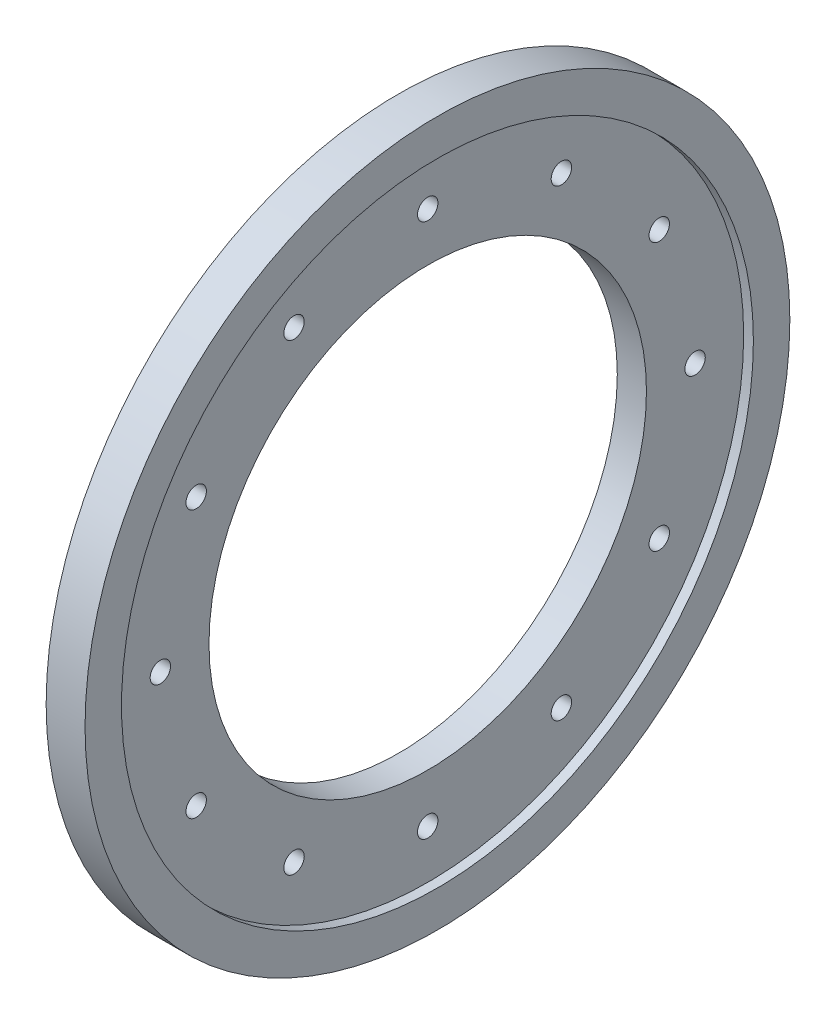
from build123d import *

# Parameters (mm, degrees)
SKETCH1_W                  = 16
SKETCH1_H                  = 145
HOLE1_D                    = 180
HOLE1_CBORE_D              = 260
HOLE1_CBORE_DEPTH          = 4
F_8_4_8_4_DIAMETER_HOLE1_D = 8.4


with BuildPart() as part:
    # Sketch1 → Revolve1 (revolve)
    with BuildSketch(Plane(origin=(0, 0, 0), x_dir=(-1, 0, 0), z_dir=(0, 0, -1)), mode=Mode.PRIVATE) as revolve1_sk:
        with Locations((4, 72.5)):
            Rectangle(SKETCH1_W, SKETCH1_H)
    revolve(revolve1_sk.sketch.rotate(Axis((4, 0, 0), (-1, 0, 0)), 270), axis=Axis((4, 0, 0), (-1, 0, 0)))

    # Hole1 (through all)
    with Locations(Plane(origin=(4, 0, 0), x_dir=(0, 0, -1), z_dir=(1, 0, 0))):
        with Locations((0, 0)):
            CounterBoreHole(HOLE1_D / 2, HOLE1_CBORE_D / 2, HOLE1_CBORE_DEPTH)

    # Ø8.4 (8.4) Diameter Hole1 (through all)
    with Locations(Plane(origin=(0, 0, 0), x_dir=(0, 0, -1), z_dir=(1, 0, 0))):
        with Locations((110, 0), (95.262794416, 55), (55, 95.262794416), (0, 110), (-55, 95.262794416), (-95.262794416, 55), (-110, 0), (-95.262794416, -55), (-55, -95.262794416), (0, -110), (55, -95.262794416), (95.262794416, -55)):
            Hole(F_8_4_8_4_DIAMETER_HOLE1_D / 2)


solid = part.part
